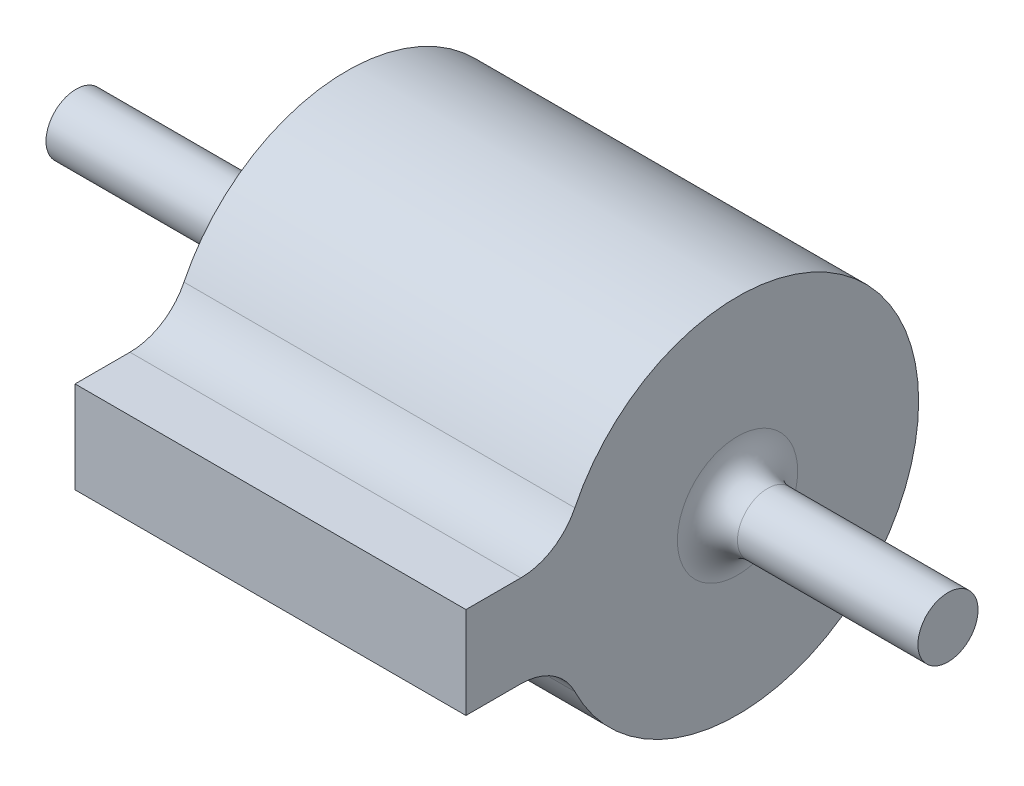
from build123d import *

# Parameters (mm, degrees)
BOSS_EXTRUDE1_DEPTH      = 130
FILLET1_R                = 20
BOSS_EXTRUDE2_DEPTH      = 90
BOSS_EXTRUDE2_DEPTH_BACK = 200
SKETCH2_R                = 10
FILLET2_R                = 10


with BuildPart() as part:
    # Sketch1 → Boss-Extrude1 (new body)
    with BuildSketch(Plane(origin=(0, 0, 0), x_dir=(0, 0, -1), z_dir=(1, 0, 0))):
        with BuildLine():
            Line((-58.27789047, 15.260561771), (-90.331379838, 15.260561771))
            Line((-90.331379838, 15.260561771), (-90.331379838, -15.260561771))
            Line((-90.331379838, -15.260561771), (-58.27789047, -15.260561771))
            ThreePointArc((-58.27789047, -15.260561771), (60.242819184, 0), (-58.27789047, 15.260561771))
        make_face()
        with BuildLine():
            ThreePointArc((-9.539392014, -3), (10, 0), (-9.539392014, 3))
            ThreePointArc((-9.539392014, 3), (-10, 0), (-9.539392014, -3))
        make_face(mode=Mode.SUBTRACT)
    extrude(amount=BOSS_EXTRUDE1_DEPTH)

    # Fillet1
    fillet1_edges = [part.edges().sort_by_distance(p)[0] for p in [
        (65, -15.260561771, 58.27789047),
        (65, 15.260561771, 58.27789047),
    ]]
    fillet(fillet1_edges, radius=FILLET1_R)

    # Sketch2 → Boss-Extrude2 (add, two sides: drawn at the far end of the back side and taken through both)
    with BuildSketch(Plane.ZY.offset(-BOSS_EXTRUDE2_DEPTH_BACK)):
        Circle(SKETCH2_R)
    extrude(amount=BOSS_EXTRUDE2_DEPTH + BOSS_EXTRUDE2_DEPTH_BACK)

    # Fillet2
    fillet2_edges = [part.edges().sort_by_distance(p)[0] for p in [
        (130, 0, -10),
        (0, 0, -10),
    ]]
    fillet(fillet2_edges, radius=FILLET2_R)


solid = part.part
